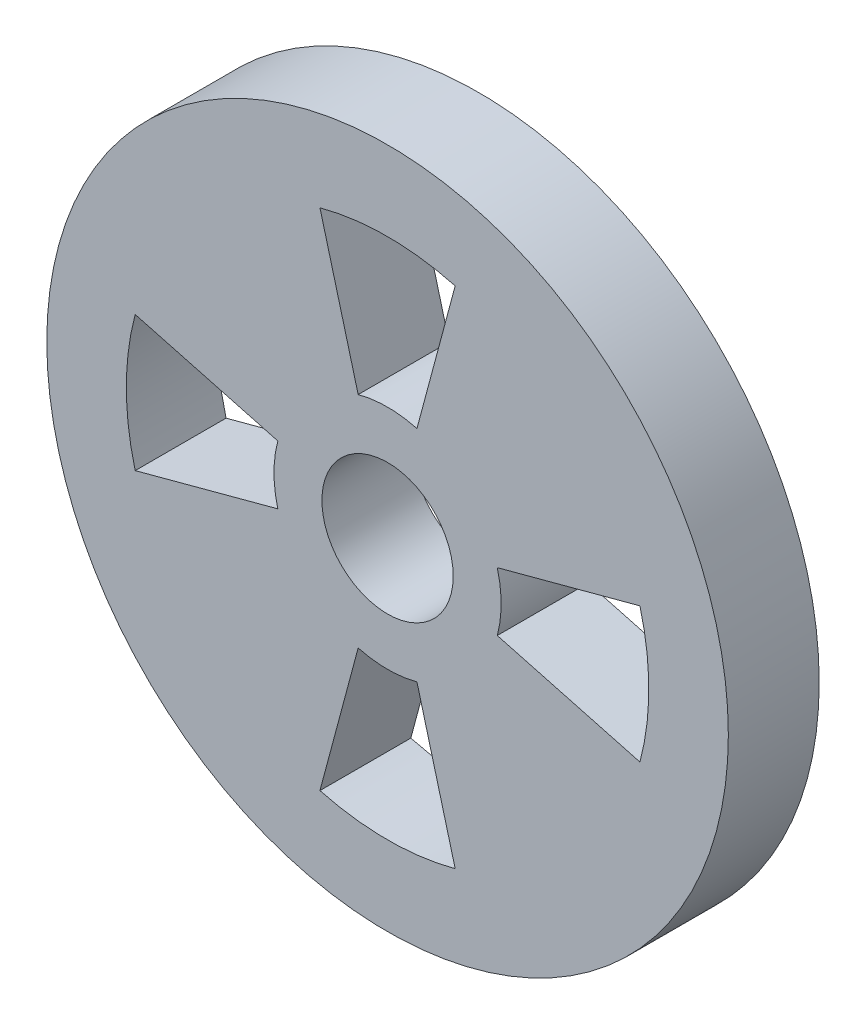
from build123d import *

# Parameters (mm, degrees)
SCHIZZO1_R                   = 15
SCHIZZO1_R_2                 = 2.89
ESTRUSIONE_ESTRUSIONE1_DEPTH = 4
TAGLIO_ESTRUSIONE1_DEPTH     = 22.587033145


with BuildPart() as part:
    # Schizzo1 → Estrusione-Estrusione1 (new body)
    with BuildSketch(Plane.XY):
        Circle(SCHIZZO1_R)
        Circle(SCHIZZO1_R_2, mode=Mode.SUBTRACT)
    extrude(amount=ESTRUSIONE_ESTRUSIONE1_DEPTH)

    # Schizzo2 → Taglio-Estrusione1 (cut, through all)
    with BuildSketch(Plane.XY.offset(4)):
        with BuildLine():
            Line((-4.829629131, -1.294095226), (-11.108147002, -2.976419019))
            ThreePointArc((-11.108147002, -2.976419019), (-11.5, 0), (-11.108147002, 2.976419019))
            Line((-11.108147002, 2.976419019), (-4.829629131, 1.294095226))
            ThreePointArc((-4.829629131, 1.294095226), (-5, 0), (-4.829629131, -1.294095226))
        make_face()
        with BuildLine():
            Line((11.108147002, -2.976419019), (4.829629131, -1.294095226))
            ThreePointArc((4.829629131, -1.294095226), (5, 0), (4.829629131, 1.294095226))
            Line((4.829629131, 1.294095226), (11.108147002, 2.976419019))
            ThreePointArc((11.108147002, 2.976419019), (11.5, 0), (11.108147002, -2.976419019))
        make_face()
        with BuildLine():
            Line((-2.976419019, 11.108147002), (-1.294095226, 4.829629131))
            ThreePointArc((-1.294095226, 4.829629131), (0, 5), (1.294095226, 4.829629131))
            Line((1.294095226, 4.829629131), (2.976419019, 11.108147002))
            ThreePointArc((2.976419019, 11.108147002), (0, 11.5), (-2.976419019, 11.108147002))
        make_face()
        with BuildLine():
            Line((-2.976419019, -11.108147002), (-1.294095226, -4.829629131))
            ThreePointArc((-1.294095226, -4.829629131), (0, -5), (1.294095226, -4.829629131))
            Line((1.294095226, -4.829629131), (2.976419019, -11.108147002))
            ThreePointArc((2.976419019, -11.108147002), (0, -11.5), (-2.976419019, -11.108147002))
        make_face()
    extrude(amount=-TAGLIO_ESTRUSIONE1_DEPTH, mode=Mode.SUBTRACT)


solid = part.part
